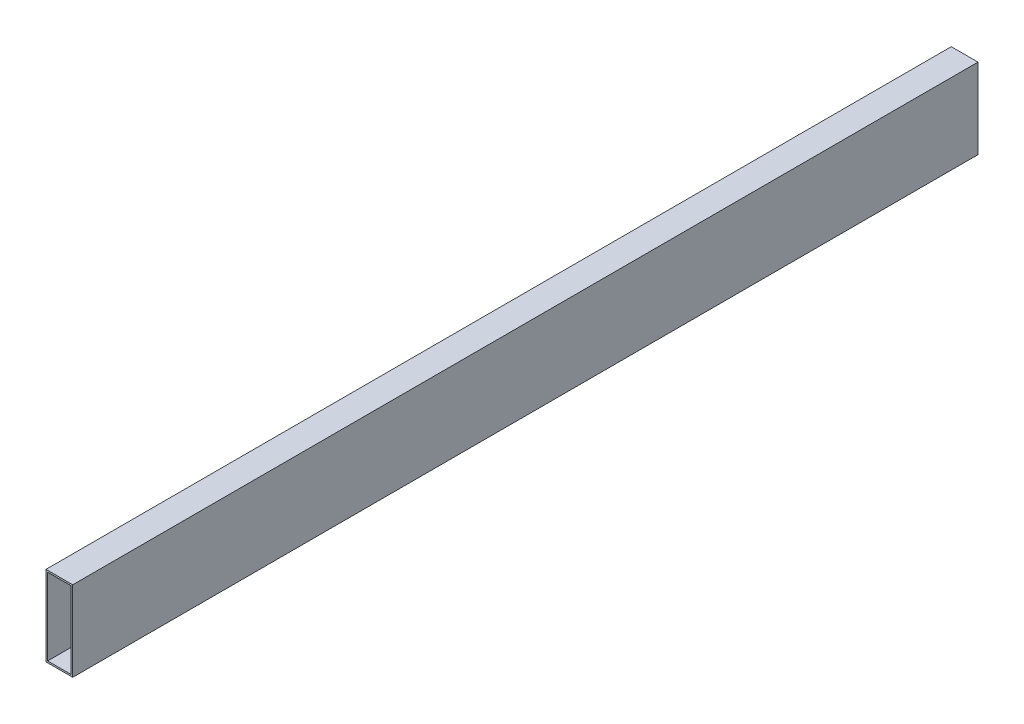
from build123d import *

# Parameters (mm, degrees)
SKETCH1_W           = 50.8
SKETCH1_H           = 152.4
BOSS_EXTRUDE1_DEPTH = 1720.85
SHELL1_T            = -3.175


with BuildPart() as part:
    # Sketch1 → Boss-Extrude1 (new body)
    with BuildSketch(Plane.XY):
        with Locations((25.4, 76.2)):
            Rectangle(SKETCH1_W, SKETCH1_H)
    extrude(amount=BOSS_EXTRUDE1_DEPTH)

    # Shell1
    shell1_openings = [part.faces().sort_by_distance(p)[0] for p in [
        (25.4, 76.2, 1720.85),
        (25.4, 76.2, 0),
    ]]
    offset(amount=SHELL1_T, openings=shell1_openings, kind=Kind.INTERSECTION)


solid = part.part
